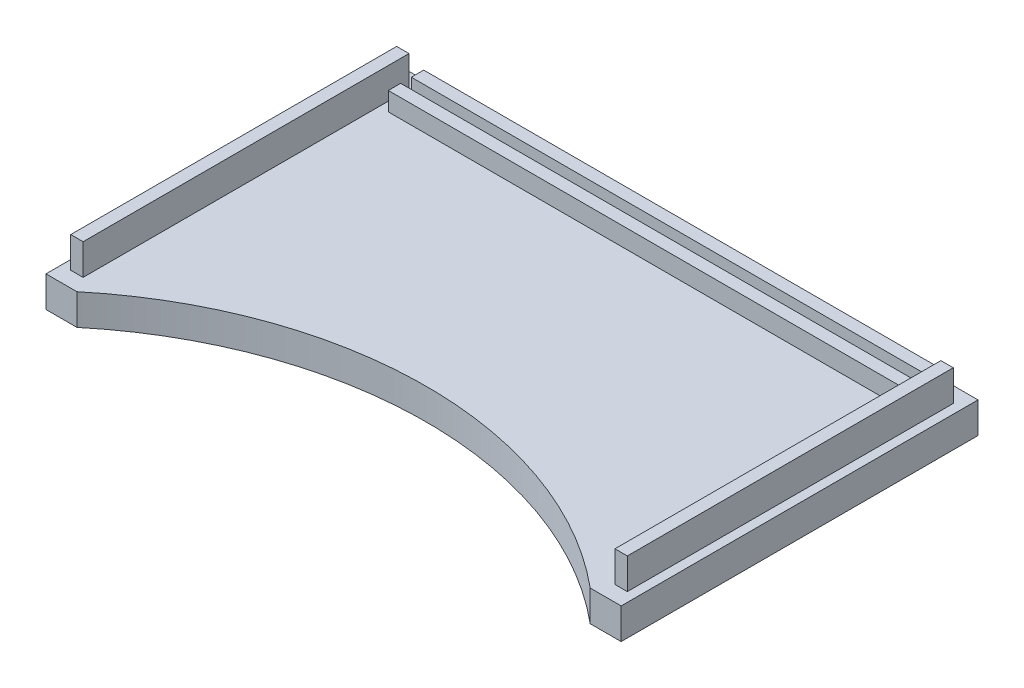
from build123d import *

# Parameters (mm, degrees)
SKETCH1_W           = 186
SKETCH1_H           = 115.4
BOSS_EXTRUDE1_DEPTH = 10
CUT_EXTRUDE5_DEPTH  = 220.119054397
SKETCH4_W           = 166
SKETCH4_H           = 4
BOSS_EXTRUDE3_DEPTH = 6
SKETCH6_W           = 4
SKETCH6_H           = 105.4
BOSS_EXTRUDE4_DEPTH = 10
SKETCH7_W           = 4
SKETCH7_H           = 105.4
BOSS_EXTRUDE5_DEPTH = 10


with BuildPart() as part:
    # Sketch1 → Boss-Extrude1 (new body)
    with BuildSketch(Plane(origin=(0, 0, 0), x_dir=(1, 0, 0), z_dir=(0, 1, 0))):
        with Locations((93, 57.7)):
            Rectangle(SKETCH1_W, SKETCH1_H)
    extrude(amount=BOSS_EXTRUDE1_DEPTH)

    # Sketch5 → Cut-Extrude5 (cut, through all)
    with BuildSketch(Plane(origin=(0, 10, 0), x_dir=(1, 0, 0), z_dir=(0, 1, 0))):
        with BuildLine():
            Line((176, 0), (10, 0))
            ThreePointArc((10, 0), (93, 30), (176, 0))
        make_face()
    extrude(amount=-CUT_EXTRUDE5_DEPTH, mode=Mode.SUBTRACT)

    # Sketch4 → Boss-Extrude3 (add)
    with BuildSketch(Plane(origin=(0, 10, 0), x_dir=(1, 0, 0), z_dir=(0, 1, 0))):
        with Locations((93, 102.7)):
            Rectangle(SKETCH4_W, SKETCH4_H)
        with Locations((93, 110.14)):
            Rectangle(SKETCH4_W, SKETCH4_H)
    extrude(amount=BOSS_EXTRUDE3_DEPTH)

    # Sketch6 → Boss-Extrude4 (add)
    with BuildSketch(Plane(origin=(0, 10, 0), x_dir=(1, 0, 0), z_dir=(0, 1, 0))):
        with Locations((181, 57.7)):
            Rectangle(SKETCH6_W, SKETCH6_H)
    extrude(amount=BOSS_EXTRUDE4_DEPTH)

    # Sketch7 → Boss-Extrude5 (add)
    with BuildSketch(Plane(origin=(0, 10, 0), x_dir=(1, 0, 0), z_dir=(0, 1, 0))):
        with Locations((5, 57.7)):
            Rectangle(SKETCH7_W, SKETCH7_H)
    extrude(amount=BOSS_EXTRUDE5_DEPTH)


solid = part.part
